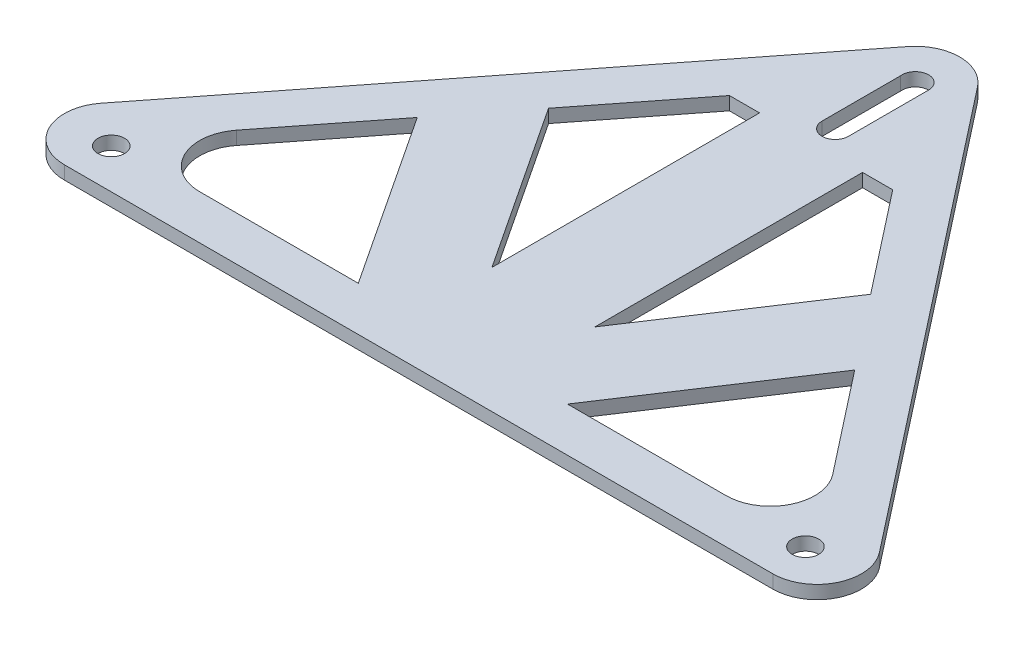
from build123d import *

# Parameters (mm, degrees)
SKETCH1_R           = 3
BOSS_EXTRUDE1_DEPTH = 3


with BuildPart() as part:
    # Sketch1 → Boss-Extrude1 (new body)
    with BuildSketch(Plane(origin=(0, 0, 0), x_dir=(1, 0, 0), z_dir=(0, 1, 0))):
        with BuildLine():
            ThreePointArc((158.232733492, -8.975009298), (167.223082652, -3.353778756), (166.106066757, 7.190266308))
            Line((166.106066757, 7.190266308), (86.179120629, 109.260558707))
            ThreePointArc((86.179120629, 109.260558707), (78.305787364, 113.095283102), (70.432454098, 109.260558707))
            Line((70.432454098, 109.260558707), (-9.49449203, 7.190266308))
            ThreePointArc((-9.49449203, 7.190266308), (-10.611507924, -3.353778756), (-1.621158764, -8.975009298))
            Line((-1.621158764, -8.975009298), (78.305787364, -8.975009298))
            Line((78.305787364, -8.975009298), (158.232733492, -8.975009298))
        make_face()
        with Locations(Location((0, 0, 0), (0, 0, 270))):
            Circle(SKETCH1_R, mode=Mode.SUBTRACT)
        with BuildLine():
            ThreePointArc((18.910520844, 1.024990702), (9.920171683, 6.646221244), (11.037187578, 17.190266308))
            Line((11.037187578, 17.190266308), (28.959351543, 40.077672933))
            Line((28.959351543, 40.077672933), (54.70682481, 1.024990702))
            Line((54.70682481, 1.024990702), (18.910520844, 1.024990702))
        make_face(mode=Mode.SUBTRACT)
        Polygon((59.887035288, 79.573711202), (66.6846286, 79.573711202), (66.6846286, 66.364650506), (66.6846286, 19.192418643), (41.964871323, 56.686304577), align=None, mode=Mode.SUBTRACT)
        with Locations(Location((156.611574728, 0, 0), (0, 0, 270))):
            Circle(SKETCH1_R, mode=Mode.SUBTRACT)
        with BuildLine():
            Line((137.701053884, 1.024990702), (101.904749918, 1.024990702))
            Line((101.904749918, 1.024990702), (127.652223184, 40.077672933))
            Line((127.652223184, 40.077672933), (145.574387149, 17.190266308))
            ThreePointArc((145.574387149, 17.190266308), (146.691403044, 6.646221244), (137.701053884, 1.024990702))
        make_face(mode=Mode.SUBTRACT)
        Polygon((114.646703405, 56.686304577), (89.926946128, 19.192418643), (89.926946128, 79.573711202), (96.72453944, 79.573711202), align=None, mode=Mode.SUBTRACT)
        with BuildLine():
            ThreePointArc((81.284347166, 85.030073249), (80.411947198, 82.923913414), (78.305787364, 82.051513446))
            ThreePointArc((78.305787364, 82.051513446), (76.199627529, 82.923913414), (75.327227561, 85.030073249))
            Line((75.327227561, 85.030073249), (75.327227561, 102.737258658))
            ThreePointArc((75.327227561, 102.737258658), (78.126454444, 106.089918256), (81.305787364, 103.095283102))
            ThreePointArc((81.305787364, 103.095283102), (81.300422517, 102.915950182), (81.284347166, 102.737258658))
            Line((81.284347166, 102.737258658), (81.284347166, 85.030073249))
        make_face(mode=Mode.SUBTRACT)
    extrude(amount=BOSS_EXTRUDE1_DEPTH)


solid = part.part
